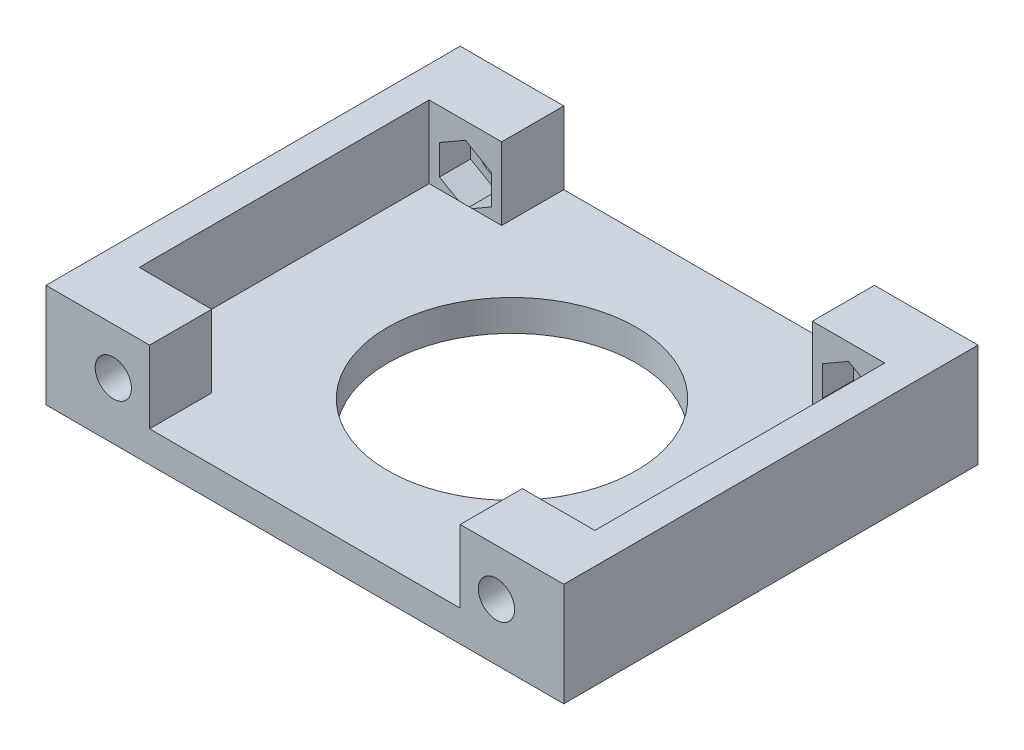
from build123d import *

# Parameters (mm, degrees)
SKETCH1_W            = 50
SKETCH1_H            = 40
BOSS_EXTRUDE1_DEPTH  = 3
SKETCH2_R            = 12
CUT_EXTRUDE1_DEPTH   = 33.155870382
SKETCH3_W            = 3
SKETCH3_H            = 40
BOSS_EXTRUDE2_DEPTH  = 7
SKETCH4_W            = 7
SKETCH4_H            = 7
BOSS_EXTRUDE3_DEPTH  = 6
SKETCH5_R            = 1.75
CUT_EXTRUDE2_DEPTH   = 49.218253805
CUT_EXTRUDE3_DEPTH   = 3
MIRROR3_COPY_1_DEPTH = 3


with BuildPart() as part:
    # Sketch1 → Boss-Extrude1 (new body)
    with BuildSketch(Plane(origin=(0, 0, 0), x_dir=(1, 0, 0), z_dir=(0, 1, 0))):
        Rectangle(SKETCH1_W, SKETCH1_H)
    extrude(amount=BOSS_EXTRUDE1_DEPTH)

    # Sketch2 → Cut-Extrude1 (cut, through all)
    with BuildSketch(Plane(origin=(0, 3, 0), x_dir=(1, 0, 0), z_dir=(0, 1, 0))):
        with Locations(Location((0, 0, 0), (0, 0, 270))):
            Circle(SKETCH2_R)
    extrude(amount=-CUT_EXTRUDE1_DEPTH, mode=Mode.SUBTRACT)

    # Sketch3 → Boss-Extrude2 (add)
    with BuildSketch(Plane(origin=(0, 3, 0), x_dir=(1, 0, 0), z_dir=(0, 1, 0))):
        with Locations((-23.5, 0)):
            Rectangle(SKETCH3_W, SKETCH3_H)
        with Locations((23.5, 0)):
            Rectangle(SKETCH3_W, SKETCH3_H)
    extrude(amount=BOSS_EXTRUDE2_DEPTH)

    # Sketch4 → Boss-Extrude3 (add)
    with BuildSketch(Plane.XY.offset(20)):
        with Locations((-18.5, 6.5)):
            Rectangle(SKETCH4_W, SKETCH4_H)
        with Locations((18.5, 6.5)):
            Rectangle(SKETCH4_W, SKETCH4_H)
    boss_extrude3 = extrude(amount=-BOSS_EXTRUDE3_DEPTH)

    # Sketch5 → Cut-Extrude2 (cut, through all)
    with BuildSketch(Plane.XY.offset(20)):
        with Locations((-18.5, 5.5)):
            Circle(SKETCH5_R)
        with Locations((18.5, 5.5)):
            Circle(SKETCH5_R)
    cut_extrude2 = extrude(amount=-CUT_EXTRUDE2_DEPTH, mode=Mode.SUBTRACT)

    # Mirror1: Boss-Extrude3, Cut-Extrude2 across plane
    add(boss_extrude3.mirror(Plane.XY))
    add(cut_extrude2.mirror(Plane.XY), mode=Mode.SUBTRACT)

    # Sketch6 → Cut-Extrude3 (cut)
    with BuildSketch(Plane.XY.offset(-14)):
        Polygon((-18.5, 2.613248654), (-16, 4.056624327), (-16, 6.943375673), (-18.5, 8.386751346), (-21, 6.943375673), (-21, 4.056624327), align=None)
    cut_extrude3 = extrude(amount=-CUT_EXTRUDE3_DEPTH, mode=Mode.SUBTRACT)

    # Mirror2: Cut-Extrude3 across plane
    add(cut_extrude3.mirror(Plane(origin=(0, 0, 0), x_dir=(0, 0, 1), z_dir=(1, 0, 0))), mode=Mode.SUBTRACT)

    # Mirror3: Cut-Extrude3 across plane
    add(cut_extrude3.mirror(Plane.XY), mode=Mode.SUBTRACT)

    # Mirror3 copy 1 sketch → Mirror3 copy 1 (cut)
    with BuildSketch(Plane(origin=(0, 0, 14), x_dir=(-1, 0, 0), z_dir=(0, 0, -1))):
        Polygon((-18.5, 2.613248654), (-16, 4.056624327), (-16, 6.943375673), (-18.5, 8.386751346), (-21, 6.943375673), (-21, 4.056624327), align=None)
    extrude(amount=-MIRROR3_COPY_1_DEPTH, mode=Mode.SUBTRACT)


solid = part.part
